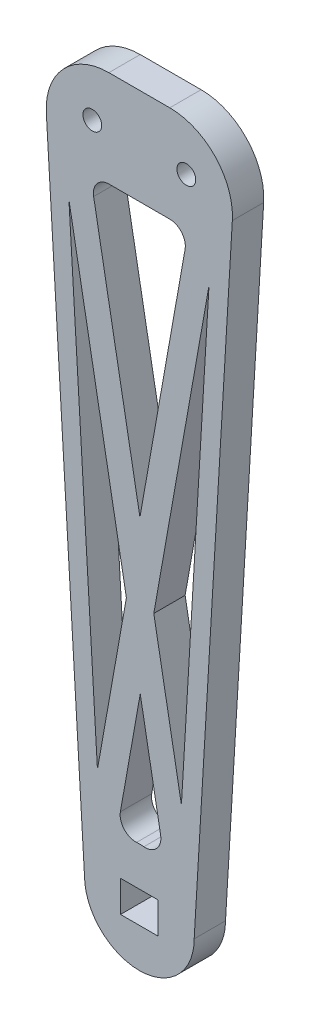
from build123d import *

# Parameters (mm, degrees)
SKETCH1_R           = 3
BOSS_EXTRUDE2_DEPTH = 10
FILLET1_R           = 20
FILLET2_R           = 20
CUT_EXTRUDE1_START  = -10
CUT_EXTRUDE1_DEPTH  = 10
FILLET3_R           = 5


with BuildPart() as part:
    # Sketch1 → Boss-Extrude2 (new body)
    with BuildSketch(Plane.XY):
        with BuildLine():
            Line((-30, 15.770412854), (-30, 0))
            Line((-30, 0), (-17.5, -210))
            ThreePointArc((-17.5, -210), (0, -227.5), (17.5, -210))
            Line((17.5, -210), (30, 0))
            Line((30, 0), (30, 15.770412854))
            Line((30, 15.770412854), (-30, 15.770412854))
        make_face()
        with Locations((-15, 0)):
            Circle(SKETCH1_R, mode=Mode.SUBTRACT)
        with Locations((15, 0)):
            Circle(SKETCH1_R, mode=Mode.SUBTRACT)
        Polygon((0, -205), (6, -205), (6, -215), (-6, -215), (-6, -205), align=None, mode=Mode.SUBTRACT)
    extrude(amount=BOSS_EXTRUDE2_DEPTH)

    # Fillet1
    fillet1_edges = [part.edges().sort_by_distance(p)[0] for p in [
        (-30, 15.770412854, 5),
    ]]
    fillet(fillet1_edges, radius=FILLET1_R)

    # Fillet2
    fillet2_edges = [part.edges().sort_by_distance(p)[0] for p in [
        (30, 15.770412854, 5),
    ]]
    fillet(fillet2_edges, radius=FILLET2_R)

    # Sketch4 → Cut-Extrude1 (cut)
    with BuildSketch(Plane.XY.offset(10).offset(CUT_EXTRUDE1_START)):
        Polygon((-15.651797422, -15), (0.190220551, -102.160979768), (15.643622882, -15), (15, -15), align=None)
        Polygon((-22.473027071, -25.6531452), (-13.367328465, -178.628881795), (-4.134156204, -126.551525408), align=None)
        Polygon((22.230419841, -27.161313899), (4.615986353, -126.511039477), (13.430162671, -175.005634359), align=None)
        with BuildLine():
            Line((0.291609598, -150.901585116), (-7.372445375, -194.128735111))
            ThreePointArc((-7.372445375, -194.128735111), (0.476576628, -192.506490497), (8.225632191, -194.553674383))
            Line((8.225632191, -194.553674383), (0.291609598, -150.901585116))
        make_face()
    extrude(amount=CUT_EXTRUDE1_DEPTH, mode=Mode.SUBTRACT)

    # Fillet3
    fillet3_edges = [part.edges().sort_by_distance(p)[0] for p in [
        (8.225632191, -194.553674383, 5),
        (-7.372445375, -194.128735111, 5),
        (-15.651797422, -15, 5),
        (15.643622882, -15, 5),
    ]]
    fillet(fillet3_edges, radius=FILLET3_R)


solid = part.part
